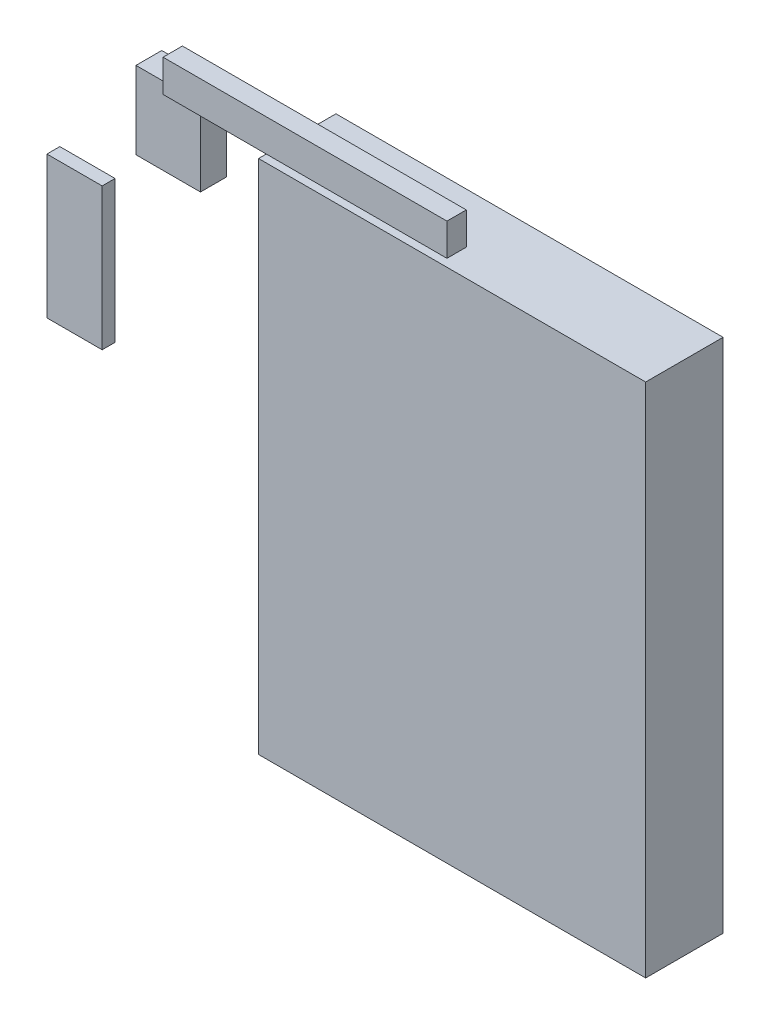
from build123d import *

# Parameters (mm, degrees)
BATTERY_START                                 = 3.6
SKETCH_1_W                                    = 30
SKETCH_1_H                                    = 40
BATTERY_POUCH_DEPTH                           = 6
BATTERY_START_2                               = 8.5
SKETCH_2_W                                    = 22
SKETCH_2_H                                    = 2.5
BATTERY_LEADS_DEPTH                           = 1.5
JST_START                                     = 7.6
SKETCH_3_W                                    = 5
SKETCH_3_H                                    = 6
JST_PLUG_WIRE_EXIT_BELOW_J4_DEPTH             = 2
MICROSD_START                                 = 2
SKETCH_4_W                                    = 4.28
SKETCH_4_H                                    = 11
MICROSD_CARD_PART_OUTSIDE_THE_CONNECTOR_DEPTH = 1


with BuildPart() as part:
    # 草圖1 → battery pouch (new body)
    with BuildSketch(Plane.XY.offset(BATTERY_START)):
        with Locations((34, 44)):
            Rectangle(SKETCH_1_W, SKETCH_1_H)
    extrude(amount=BATTERY_POUCH_DEPTH)


with BuildPart() as body_2:
    # 草圖2 → battery leads (new body)
    with BuildSketch(Plane.XY.offset(BATTERY_START_2)):
        with Locations((23, 66.25)):
            Rectangle(SKETCH_2_W, SKETCH_2_H)
    extrude(amount=BATTERY_LEADS_DEPTH)

    # 草圖3 → JST plug wire exit below J4 (add)
    with BuildSketch(Plane.XY.offset(JST_START)):
        with Locations((12, 62.5)):
            Rectangle(SKETCH_3_W, SKETCH_3_H)
    extrude(amount=JST_PLUG_WIRE_EXIT_BELOW_J4_DEPTH)


with BuildPart() as body_3:
    # 草圖4 → microSD card, part outside the connector (new body)
    with BuildSketch(Plane.XY.offset(MICROSD_START)):
        with Locations((-1.86, 44)):
            Rectangle(SKETCH_4_W, SKETCH_4_H)
    extrude(amount=MICROSD_CARD_PART_OUTSIDE_THE_CONNECTOR_DEPTH)


solid = Compound([part.part, body_2.part, body_3.part])
